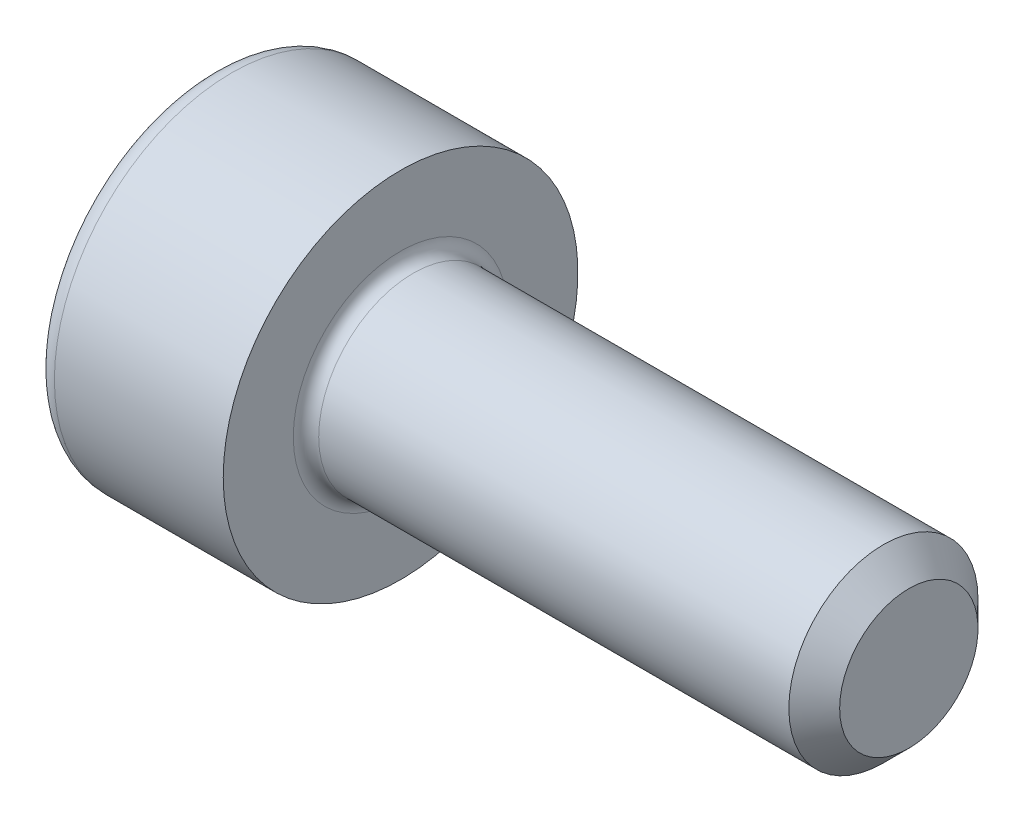
from build123d import *

# Parameters (mm, degrees)
FILLET1_R      = 0.1
FILLET2_R      = 0.16
CHAMFER1_SIZE  = 0.2
EXTRUDE1_DEPTH = 0.7


with BuildPart() as part:
    # Sketch1 → Revolve1 (revolve)
    with BuildSketch(Plane.XY, mode=Mode.PRIVATE) as revolve1_sk:
        Polygon((0, 1.395688245), (0, 0), (5.488734128, 0), (5.488734128, 0.744367064), (1.488734128, 0.744367064), (1.488734128, 1.395688245), align=None)
    revolve(revolve1_sk.sketch.rotate(Axis((0, 0, 0), (1, 0, 0)), 90), axis=Axis((0, 0, 0), (1, 0, 0)))

    # Fillet1
    fillet1_edges = [part.edges().sort_by_distance(p)[0] for p in [
        (1.488734128, 0, -0.744367064),
    ]]
    fillet(fillet1_edges, radius=FILLET1_R)

    # Fillet2
    fillet2_edges = [part.edges().sort_by_distance(p)[0] for p in [
        (0, 0, -1.395688245),
    ]]
    fillet(fillet2_edges, radius=FILLET2_R)

    # Chamfer1
    chamfer1_edges = [part.edges().sort_by_distance(p)[0] for p in [
        (5.488734128, 0, -0.744367064),
    ]]
    chamfer(chamfer1_edges, length=CHAMFER1_SIZE)

    # Sketch2 → Extrude1 (cut)
    with BuildSketch(Plane.ZY):
        Polygon((0, 0.877572409), (-0.76, 0.438786205), (-0.76, -0.438786205), (0, -0.877572409), (0.76, -0.438786205), (0.76, 0.438786205), align=None)
    extrude(amount=-EXTRUDE1_DEPTH, mode=Mode.SUBTRACT)


solid = part.part
